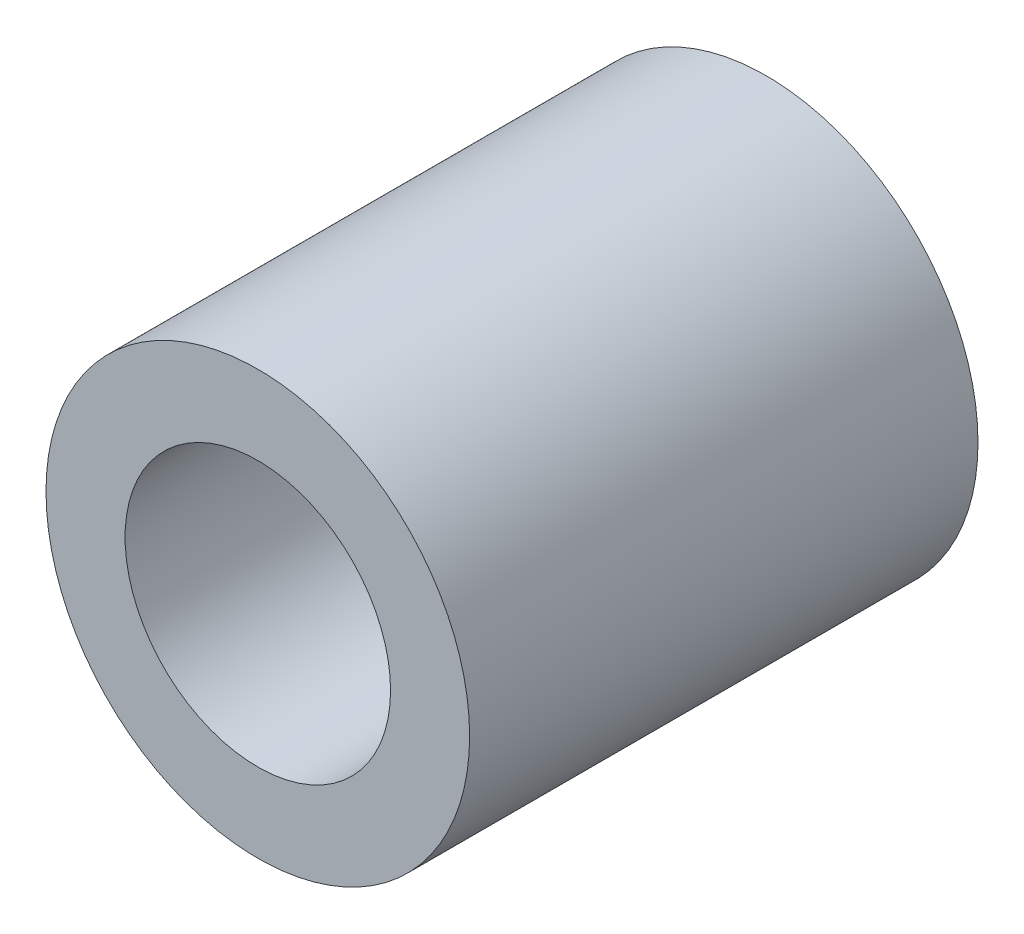
from build123d import *

# Parameters (mm, degrees)
SKETCH1_R           = 4.7625
SKETCH1_R_2         = 2.9845
BOSS_EXTRUDE1_DEPTH = 11.43


with BuildPart() as part:
    # Sketch1 → Boss-Extrude1 (new body)
    with BuildSketch(Plane.XY):
        Circle(SKETCH1_R)
        Circle(SKETCH1_R_2, mode=Mode.SUBTRACT)
    extrude(amount=BOSS_EXTRUDE1_DEPTH)


solid = part.part
